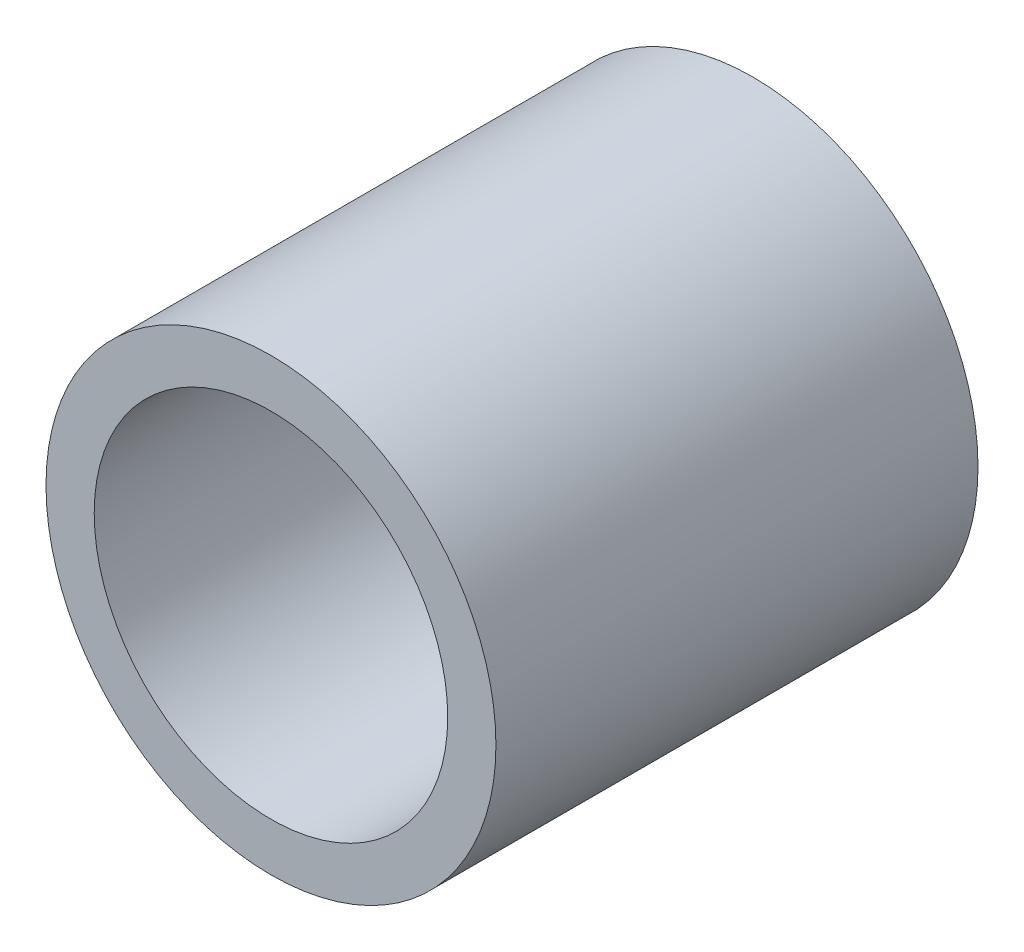
from build123d import *

# Parameters (mm, degrees)
SKETCH3_R           = 35
SKETCH3_R_2         = 27.5
BOSS_EXTRUDE4_DEPTH = 75


with BuildPart() as part:
    # Sketch3 → Boss-Extrude4 (new body)
    with BuildSketch(Plane.XY):
        with Locations((74.869963403, 3.554945105)):
            Circle(SKETCH3_R)
        with Locations((74.869963403, 3.554945105)):
            Circle(SKETCH3_R_2, mode=Mode.SUBTRACT)
    extrude(amount=-BOSS_EXTRUDE4_DEPTH)


solid = part.part
